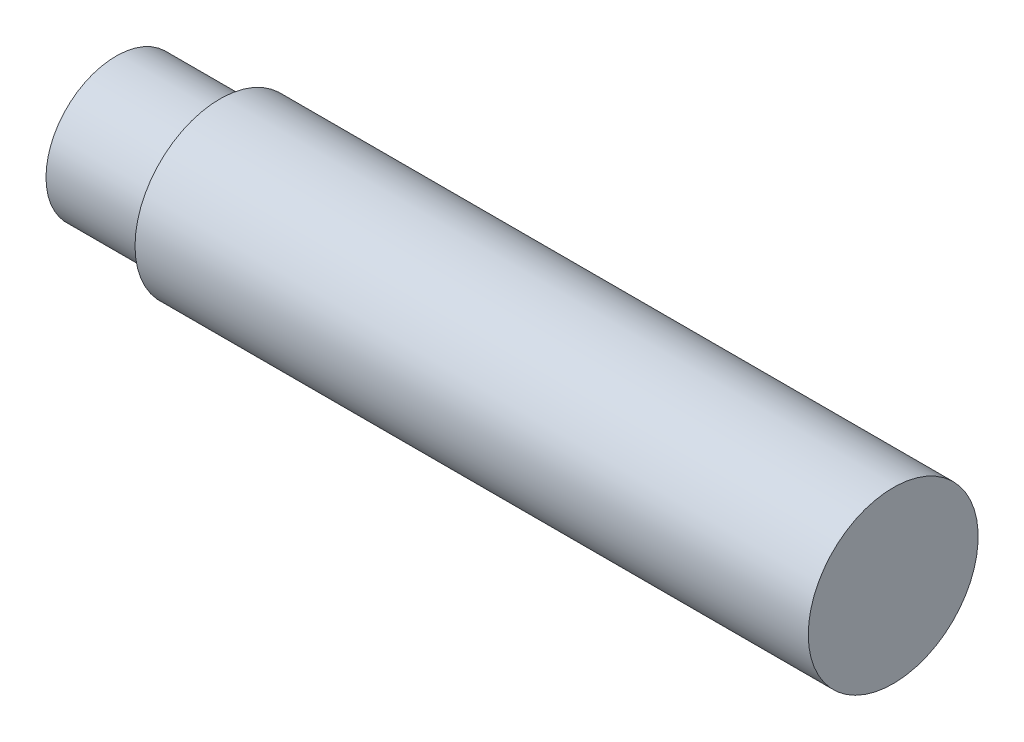
from build123d import *

# Parameters (mm, degrees)
F_4_40_TAPPED_HOLE1_D           = 2.2606
F_4_40_TAPPED_HOLE1_DEPTH       = 10.414
F_4_40_TAPPED_HOLE1_CSINK_D     = 3.175
F_4_40_TAPPED_HOLE1_CSINK_ANGLE = 60
F_4_40_TAPPED_HOLE1_TIP         = 0.679152758


with BuildPart() as part:
    # Sketch3 → Revolve1 (revolve)
    with BuildSketch(Plane.XY, mode=Mode.PRIVATE) as revolve1_sk:
        Polygon((0, 0), (0, -1.9685), (2.921, -1.9685), (2.921, -2.3876), (21.844, -2.3876), (21.844, 0), align=None)
    revolve(revolve1_sk.sketch.rotate(Axis((0, 0, 0), (1, 0, 0)), 270), axis=Axis((0, 0, 0), (1, 0, 0)))

    # #4-40 Tapped Hole1
    with Locations(Plane.ZY):
        with Locations((0, 0)):
            CounterSinkHole(F_4_40_TAPPED_HOLE1_D / 2, F_4_40_TAPPED_HOLE1_CSINK_D / 2, depth=F_4_40_TAPPED_HOLE1_DEPTH, counter_sink_angle=F_4_40_TAPPED_HOLE1_CSINK_ANGLE)
            with Locations((0, 0, -(F_4_40_TAPPED_HOLE1_DEPTH + F_4_40_TAPPED_HOLE1_TIP / 2))):  # 118° drill point
                Cone(0, F_4_40_TAPPED_HOLE1_D / 2, F_4_40_TAPPED_HOLE1_TIP, mode=Mode.SUBTRACT)


solid = part.part
